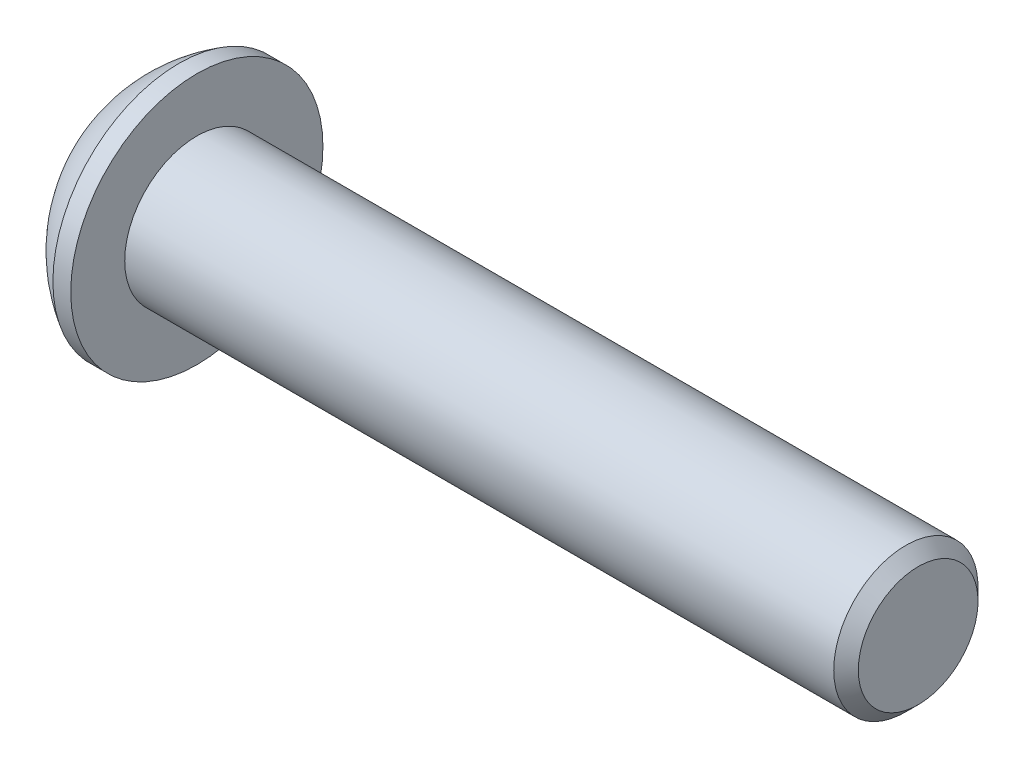
from build123d import *

# Parameters (mm, degrees)
HEX_2_DEPTH = 2.2098


with BuildPart() as part:
    # BodySke → BaseBody (revolve)
    with BuildSketch(Plane.XY, mode=Mode.PRIVATE) as basebody_sk:
        with BuildLine():
            Line((35.1028, 0), (35.1028, 2.63398))
            Line((35.1028, 2.63398), (34.56178, 3.175))
            Line((34.56178, 3.175), (3.3528, 3.175))
            Line((3.3528, 3.175), (3.3528, 5.5499))
            Line((3.3528, 5.5499), (2.5654, 5.5499))
            ThreePointArc((2.5654, 5.5499), (1.073764503, 4.355582759), (0, 2.77495))
            Line((0, 2.77495), (0, 0))
            Line((0, 0), (35.1028, 0))
        make_face()
    revolve(basebody_sk.sketch.rotate(Axis((0, 0, 0), (1, 0, 0)), 90), axis=Axis((0, 0, 0), (1, 0, 0)))

    # Sketch2 → PreBroach (revolve, cut)
    with BuildSketch(Plane.XY, mode=Mode.PRIVATE) as prebroach_sk:
        Polygon((0, 1.9812), (2.2098, 1.9812), (3.353646353, 0), (0, 0), align=None)
    revolve(prebroach_sk.sketch.rotate(Axis((0, 0, 0), (1, 0, 0)), 90), axis=Axis((0, 0, 0), (1, 0, 0)), mode=Mode.SUBTRACT)

    # Sketch3 → Hex 2 (cut)
    with BuildSketch(Plane(origin=(0, 0, 0), x_dir=(0, 0, -1), z_dir=(1, 0, 0))):
        Polygon((-1.9812, -1.143846353), (-1.9812, 1.143846353), (0, 2.287692707), (1.9812, 1.143846353), (1.9812, -1.143846353), (0, -2.287692707), align=None)
    extrude(amount=HEX_2_DEPTH, mode=Mode.SUBTRACT)


solid = part.part
